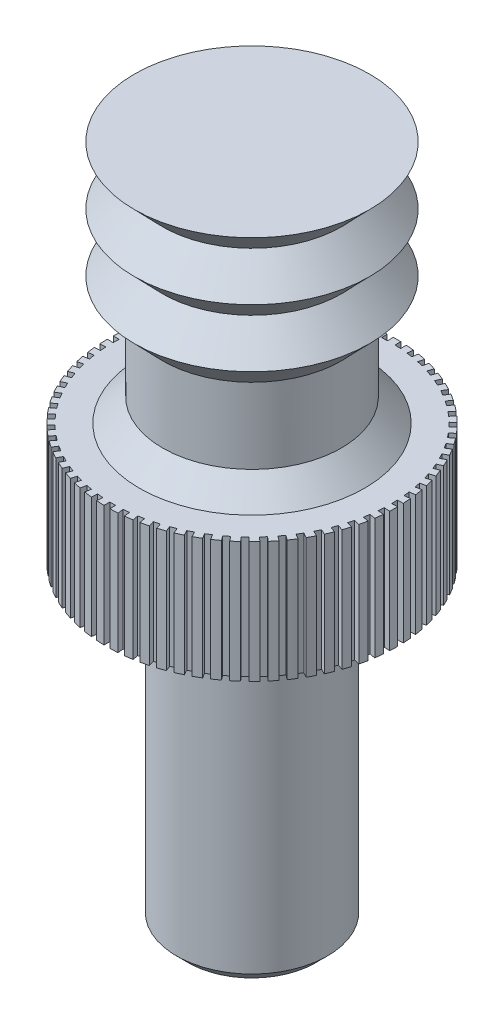
from build123d import *

# Parameters (mm, degrees)
SKETCH2_R          = 2
CUT_EXTRUDE1_DEPTH = 10
CHAMFER1_SIZE      = 2
SKETCH3_W          = 0.5
SKETCH3_H          = 3.690223229
CUT_EXTRUDE2_DEPTH = 37.051579716
CIRPATTERN1_COUNT  = 67
CHAMFER2_SIZE      = 1


with BuildPart() as part:
    # Sketch1 → Revolve1 (revolve)
    with BuildSketch(Plane.XY, mode=Mode.PRIVATE) as revolve1_sk:
        Polygon((0, 0), (3, 0), (3, 1), (2.5, 1), (2.5, 1.5), (6.5, 1.5), (6.5, 28.58), (12.5, 28.58), (12.5, 39), (7.7, 39), (7.7, 47.5), (10.125, 50), (7.7, 52.5), (10.125, 55), (7.7, 57.5), (10.125, 60), (0, 60), align=None)
    revolve(revolve1_sk.sketch.rotate(Axis((0, 0, 0), (0, 1, 0)), 90), axis=Axis((0, 0, 0), (0, 1, 0)))

    # Sketch2 → Cut-Extrude1 (cut)
    with BuildSketch(Plane.XZ):
        with Locations(Location((0, 0, 0), (0, 0, 270))):
            Circle(SKETCH2_R)
    extrude(amount=-CUT_EXTRUDE1_DEPTH, mode=Mode.SUBTRACT)

    # Chamfer1
    chamfer1_edges = [part.edges().sort_by_distance(p)[0] for p in [
        (0, 39, 7.7),
    ]]
    chamfer(chamfer1_edges, length=CHAMFER1_SIZE)

    # Sketch3 → Cut-Extrude2 (cut, through all)
    with BuildSketch(Plane.XZ.offset(-28.58)):
        with Locations((0, 13.845111615)):
            Rectangle(SKETCH3_W, SKETCH3_H)
    cut_extrude2 = extrude(amount=-CUT_EXTRUDE2_DEPTH, mode=Mode.SUBTRACT)

    # CirPattern1: Cut-Extrude2 ×67 about axis
    cirpattern1_axis = Axis((0, 0, 0), (0, 1, 0))
    for i in range(1, CIRPATTERN1_COUNT):
        add(cut_extrude2.rotate(cirpattern1_axis, i * 360 / CIRPATTERN1_COUNT), mode=Mode.SUBTRACT)

    # Chamfer2
    chamfer2_edges = [part.edges().sort_by_distance(p)[0] for p in [
        (0, 1.5, 6.5),
    ]]
    chamfer(chamfer2_edges, length=CHAMFER2_SIZE)


solid = part.part
